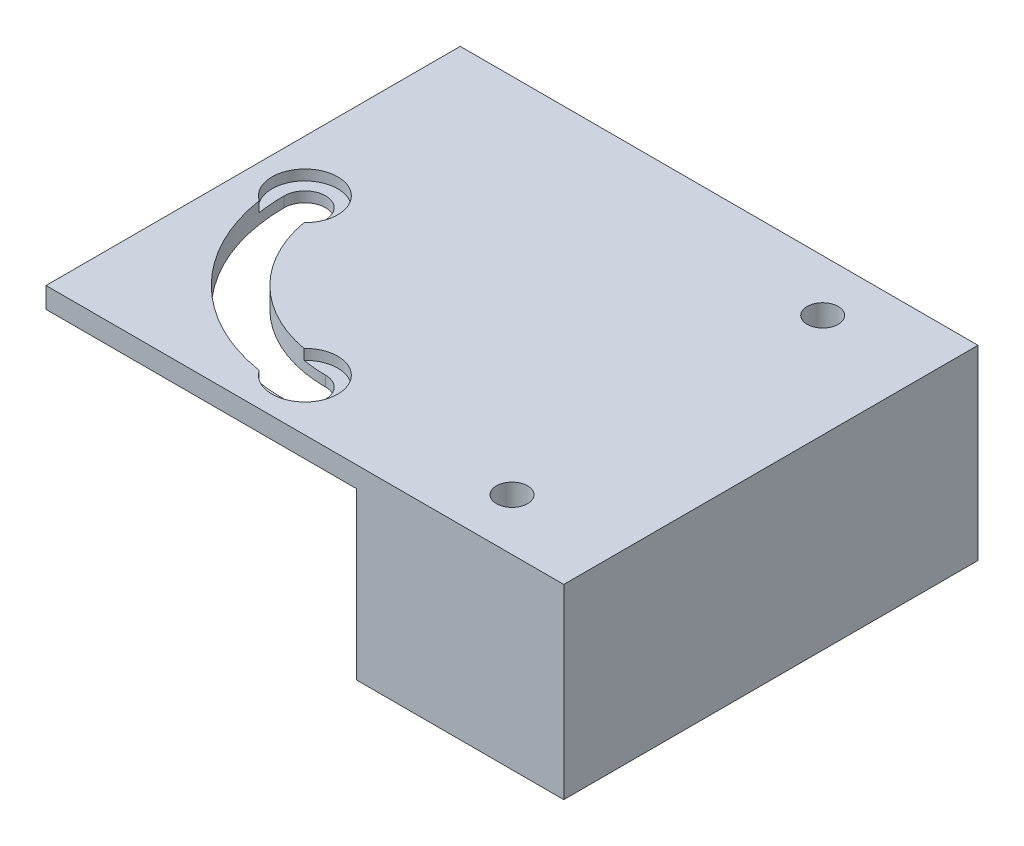
from build123d import *

# Parameters (mm, degrees)
SKETCH1_W             = 60
SKETCH1_H             = 40
BOSS_EXTRUDE1_DEPTH   = 2
CUT_EXTRUDE1_DEPTH    = 14
SKETCH5_R             = 3.5
BOSS_EXTRUDE3_DEPTH   = 16
SKETCH6_W             = 30
SKETCH6_H             = 40
BOSS_EXTRUDE4_DEPTH   = 16
SKETCH8_R             = 3.175
CUT_EXTRUDE2_DEPTH    = 1
SKETCH9_W             = 10
SKETCH9_H             = 40
CUT_EXTRUDE3_DEPTH    = 20
F_3_0MM_DOWEL_HOLE1_D = 3


with BuildPart() as part:
    # Sketch1 → Boss-Extrude1 (new body)
    with BuildSketch(Plane(origin=(0, 0, 0), x_dir=(1, 0, 0), z_dir=(0, 1, 0))):
        Rectangle(SKETCH1_W, SKETCH1_H)
    extrude(amount=BOSS_EXTRUDE1_DEPTH)

    # Sketch4 → Cut-Extrude1 (cut)
    with BuildSketch(Plane(origin=(0, 2, 0), x_dir=(1, 0, 0), z_dir=(0, 1, 0))):
        with BuildLine():
            ThreePointArc((-23, 0), (-19.192388155, -9.192388155), (-10, -13))
            ThreePointArc((-10, -13), (-8, -15), (-10, -17))
            ThreePointArc((-10, -17), (-22.02081528, -12.02081528), (-27, 0))
            ThreePointArc((-27, 0), (-25, 2), (-23, 0))
        make_face()
    extrude(amount=-CUT_EXTRUDE1_DEPTH, mode=Mode.SUBTRACT)

    # Sketch5 → Boss-Extrude3 (add)
    with BuildSketch(Plane.XZ):
        with Locations(Location((-10, 0, 0), (0, 0, 90))):
            Circle(SKETCH5_R)
    extrude(amount=BOSS_EXTRUDE3_DEPTH)

    # Sketch6 → Boss-Extrude4 (add)
    with BuildSketch(Plane.XZ):
        with Locations((15, 0)):
            Rectangle(SKETCH6_W, SKETCH6_H)
    extrude(amount=BOSS_EXTRUDE4_DEPTH)

    # Sketch8 → Cut-Extrude2 (cut)
    with BuildSketch(Plane(origin=(0, 2, 0), x_dir=(1, 0, 0), z_dir=(0, 1, 0))):
        with Locations((-25, 0)):
            Circle(SKETCH8_R)
        with Locations((-10, -15)):
            Circle(SKETCH8_R)
    extrude(amount=-CUT_EXTRUDE2_DEPTH, mode=Mode.SUBTRACT)

    # Sketch9 → Cut-Extrude3 (cut)
    with BuildSketch(Plane(origin=(0, 2, 0), x_dir=(1, 0, 0), z_dir=(0, 1, 0))):
        with Locations((25, 0)):
            Rectangle(SKETCH9_W, SKETCH9_H)
    extrude(amount=-CUT_EXTRUDE3_DEPTH, mode=Mode.SUBTRACT)

    # Ø3.0mm Dowel Hole1 (through all)
    with Locations(Plane(origin=(0, 2, 0), x_dir=(1, 0, 0), z_dir=(0, 1, 0))):
        with Locations((10, 15), (10, -15)):
            Hole(F_3_0MM_DOWEL_HOLE1_D / 2)


solid = part.part
